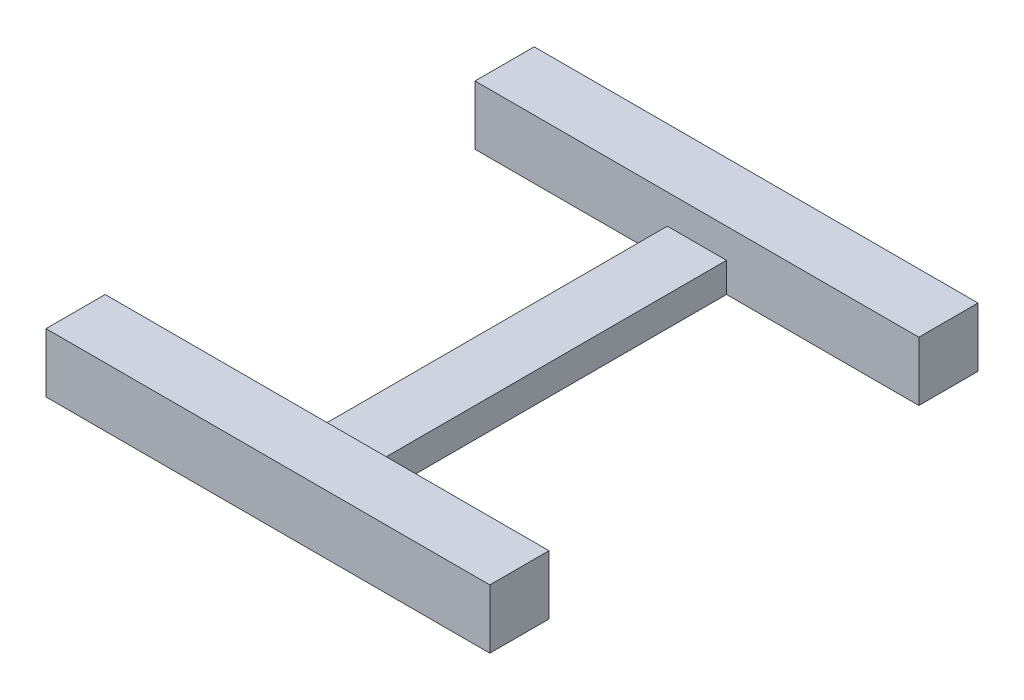
from build123d import *

# Parameters (mm, degrees)
BOSS_EXTRUDE1_DEPTH = 4
SKETCH2_W           = 4
SKETCH2_H           = 25
CUT_EXTRUDE1_DEPTH  = 2


with BuildPart() as part:
    # Sketch1 → Boss-Extrude1 (new body)
    with BuildSketch(Plane(origin=(0, 0, 0), x_dir=(1, 0, 0), z_dir=(0, 1, 0))):
        Polygon((-15, 12.5), (-2, 12.5), (-2, -12.5), (-15, -12.5), (-15, -16.5), (15, -16.5), (15, -12.5), (2, -12.5), (2, 12.5), (15, 12.5), (15, 16.5), (-15, 16.5), align=None)
    extrude(amount=BOSS_EXTRUDE1_DEPTH)

    # Sketch2 → Cut-Extrude1 (cut)
    with BuildSketch(Plane(origin=(0, 4, 0), x_dir=(1, 0, 0), z_dir=(0, 1, 0))):
        Rectangle(SKETCH2_W, SKETCH2_H)
    extrude(amount=-CUT_EXTRUDE1_DEPTH, mode=Mode.SUBTRACT)


solid = part.part
